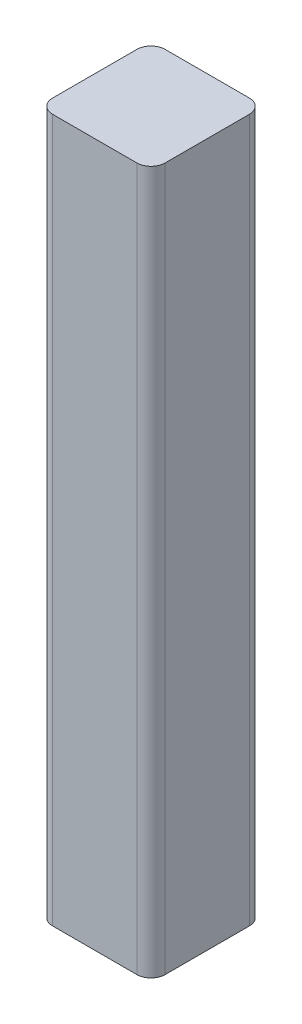
from build123d import *

# Parameters (mm, degrees)
SKETCH2_W           = 16
SKETCH2_H           = 100
BOSS_EXTRUDE1_DEPTH = 16
FILLET1_R           = 2


with BuildPart() as part:
    # Sketch2 → Boss-Extrude1 (new body)
    with BuildSketch(Plane(origin=(0, 0.289898766, 7.754792002), x_dir=(1, 0, 0), z_dir=(0, 0, 1))):
        Rectangle(SKETCH2_W, SKETCH2_H)
    extrude(amount=-BOSS_EXTRUDE1_DEPTH)

    # Fillet1
    fillet1_edges = [part.edges().sort_by_distance(p)[0] for p in [
        (8, 0.289898766, -8.245207998),
        (-8, 0.289898766, -8.245207998),
        (8, 0.289898766, 7.754792002),
        (-8, 0.289898766, 7.754792002),
    ]]
    fillet(fillet1_edges, radius=FILLET1_R)


solid = part.part
